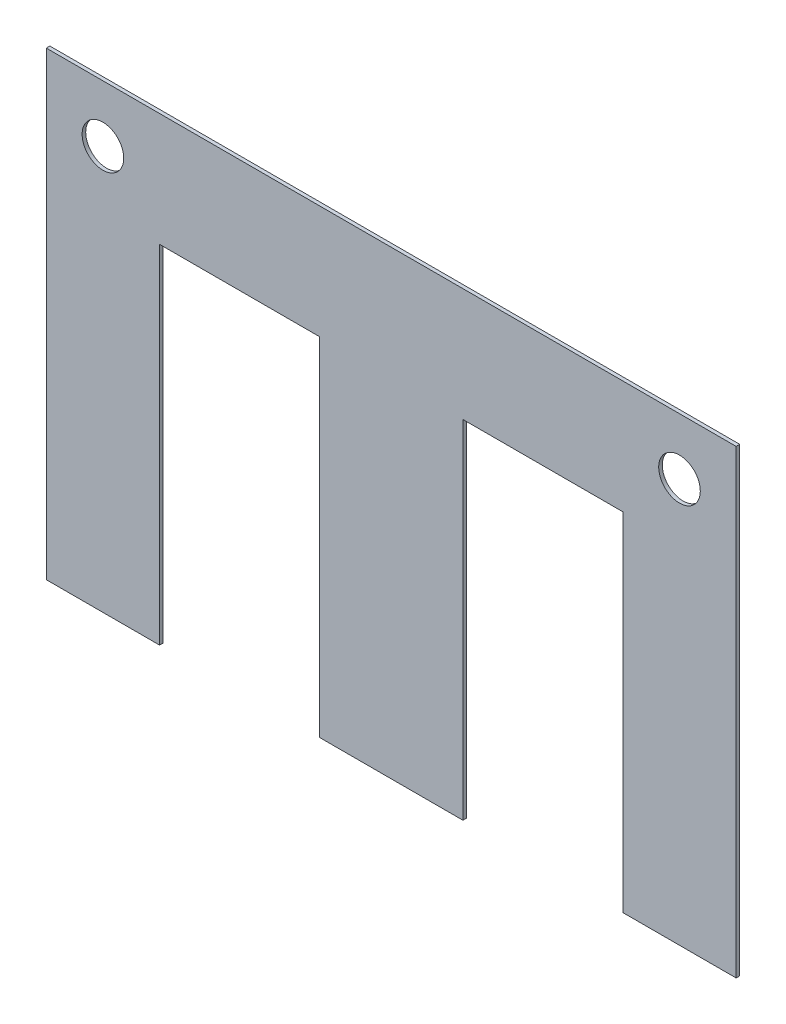
from build123d import *

# Parameters (mm, degrees)
SKETCH1_R           = 2.9
BOSS_EXTRUDE1_DEPTH = 0.25


with BuildPart() as part:
    # Sketch1 → Boss-Extrude1 (new, symmetric)
    with BuildSketch(Plane.XY):
        Polygon((-48.1, 32.1), (48.1, 32.1), (48.1, -32.1), (32.3, -32.1), (32.3, 16.3), (10, 16.3), (10, -32.1), (-10, -32.1), (-10, 16.3), (-32.3, 16.3), (-32.3, -32.1), (-48.1, -32.1), align=None)
        with Locations((40.2, 24.2)):
            Circle(SKETCH1_R, mode=Mode.SUBTRACT)
        with Locations(Location((-40.2, 24.2, 0), (0, 0, 180))):
            Circle(SKETCH1_R, mode=Mode.SUBTRACT)
    extrude(amount=BOSS_EXTRUDE1_DEPTH, both=True)


solid = part.part
